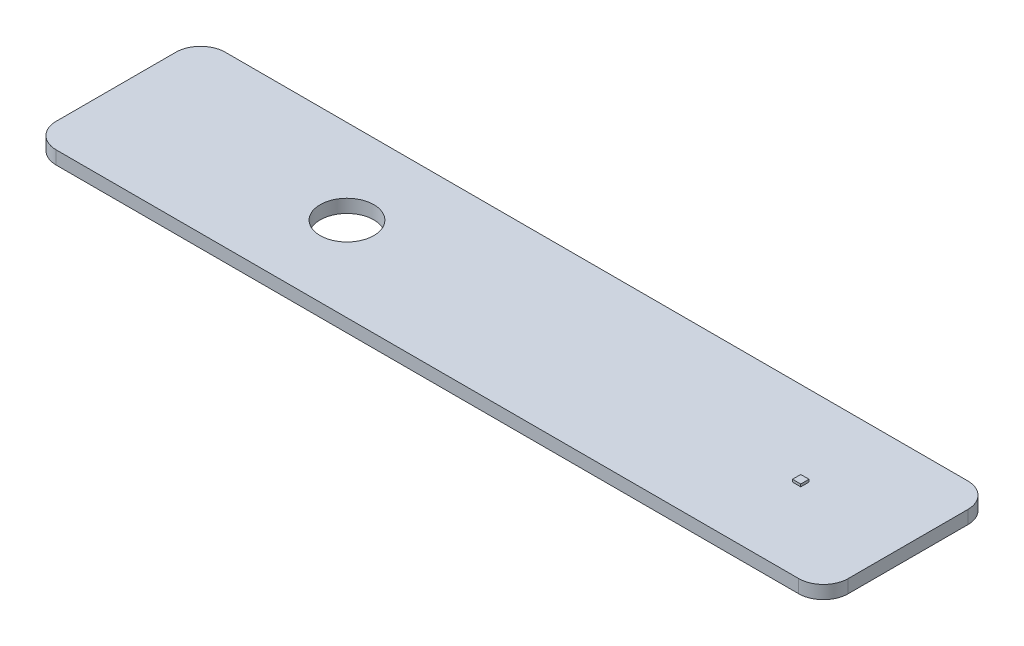
from build123d import *

# Parameters (mm, degrees)
BOSS_EXTRUDE1_DEPTH = 1.6
SKETCH2_W           = 1
SKETCH2_H           = 1
BOSS_EXTRUDE2_DEPTH = 0.3
SKETCH3_R           = 3.25
CUT_EXTRUDE1_DEPTH  = 50.108273234


with BuildPart() as part:
    # Sketch1 → Boss-Extrude1 (new body)
    with BuildSketch(Plane(origin=(0, 0, 0), x_dir=(1, 0, 0), z_dir=(0, 1, 0))):
        with BuildLine():
            Line((-45, 10.25), (45, 10.25))
            ThreePointArc((45, 10.25), (47.121320344, 9.371320344), (48, 7.25))
            Line((48, 7.25), (48, -7.25))
            ThreePointArc((48, -7.25), (47.121320344, -9.371320344), (45, -10.25))
            Line((45, -10.25), (-45, -10.25))
            ThreePointArc((-45, -10.25), (-47.121320344, -9.371320344), (-48, -7.25))
            Line((-48, -7.25), (-48, 7.25))
            ThreePointArc((-48, 7.25), (-47.121320344, 9.371320344), (-45, 10.25))
        make_face()
    extrude(amount=BOSS_EXTRUDE1_DEPTH)

    # Sketch2 → Boss-Extrude2 (add)
    with BuildSketch(Plane(origin=(0, 1.6, 0), x_dir=(1, 0, 0), z_dir=(0, 1, 0))):
        with Locations((35, 0)):
            Rectangle(SKETCH2_W, SKETCH2_H)
    extrude(amount=BOSS_EXTRUDE2_DEPTH)

    # Sketch3 → Cut-Extrude1 (cut, through all)
    with BuildSketch(Plane(origin=(0, 1.6, 0), x_dir=(1, 0, 0), z_dir=(0, 1, 0))):
        with Locations(Location((-20, 0, 0), (0, 0, 270))):
            Circle(SKETCH3_R)
    extrude(amount=-CUT_EXTRUDE1_DEPTH, mode=Mode.SUBTRACT)


solid = part.part
